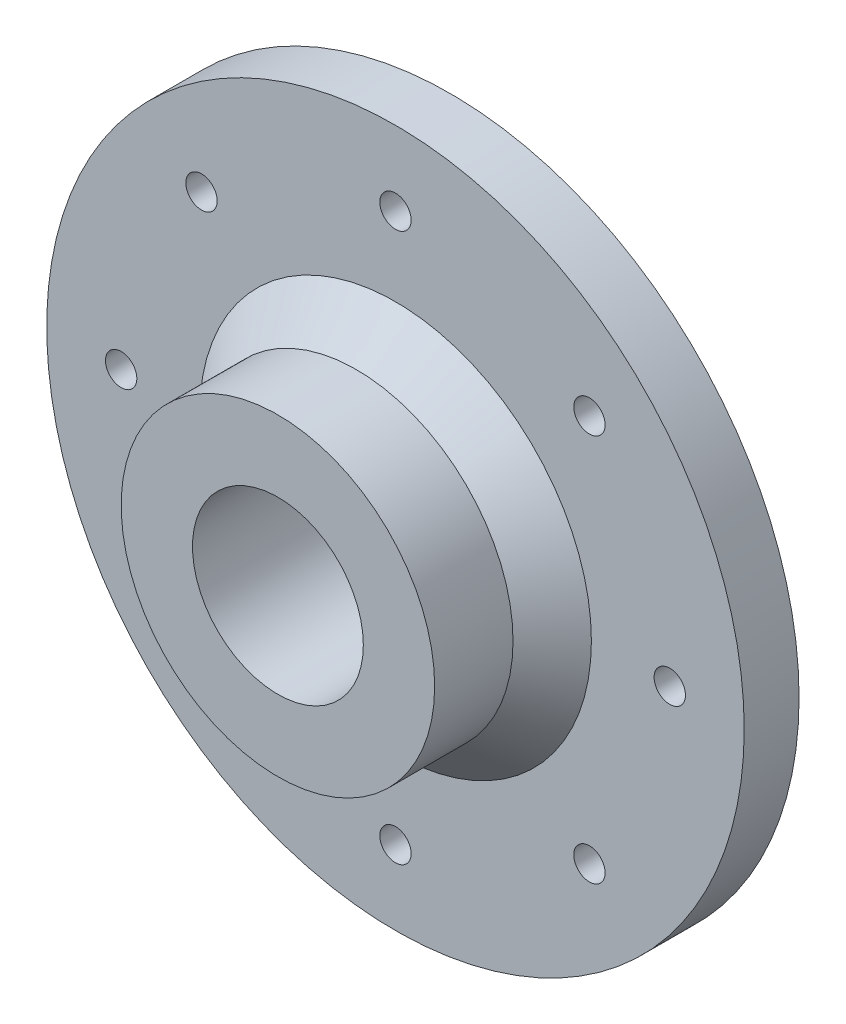
from build123d import *

# Parameters (mm, degrees)
SKETCH_1_R          = 44.5
SKETCH_1_R_2        = 10.9
EXTRUDE_1_DEPTH     = 7
SKETCH_2_R          = 20
SKETCH_2_R_2        = 10.9
EXTRUDE_2_DEPTH     = 15
SKETCH_3_R          = 2
CUT_EXTRUDE_3_DEPTH = 65.695440334
CHAMFER_1_SIZE      = 5


with BuildPart() as part:
    # Эскиз1 → Вытянуть1 (new body)
    with BuildSketch(Plane.XY):
        Circle(SKETCH_1_R)
        Circle(SKETCH_1_R_2, mode=Mode.SUBTRACT)
    extrude(amount=EXTRUDE_1_DEPTH)

    # Эскиз2 → Вытянуть2 (add)
    with BuildSketch(Plane.XY.offset(7)):
        Circle(SKETCH_2_R)
        Circle(SKETCH_2_R_2, mode=Mode.SUBTRACT)
    extrude(amount=EXTRUDE_2_DEPTH)

    # Эскиз3 → Вытянуть3 (cut, through all)
    with BuildSketch(Plane.XY.offset(7)):
        with Locations((0, 35)):
            Circle(SKETCH_3_R)
        with Locations((24.748737342, 24.748737342)):
            Circle(SKETCH_3_R)
        with Locations((35, 0)):
            Circle(SKETCH_3_R)
        with Locations((24.748737342, -24.748737342)):
            Circle(SKETCH_3_R)
        with Locations((0, -35)):
            Circle(SKETCH_3_R)
        with Locations((-24.748737342, -24.748737342)):
            Circle(SKETCH_3_R)
        with Locations((-35, 0)):
            Circle(SKETCH_3_R)
        with Locations((-24.748737342, 24.748737342)):
            Circle(SKETCH_3_R)
    extrude(amount=-CUT_EXTRUDE_3_DEPTH, mode=Mode.SUBTRACT)

    # Фаска1
    chamfer_1_edges = [part.edges().sort_by_distance(p)[0] for p in [
        (-20, 0, 7),
    ]]
    chamfer(chamfer_1_edges, length=CHAMFER_1_SIZE)


solid = part.part
